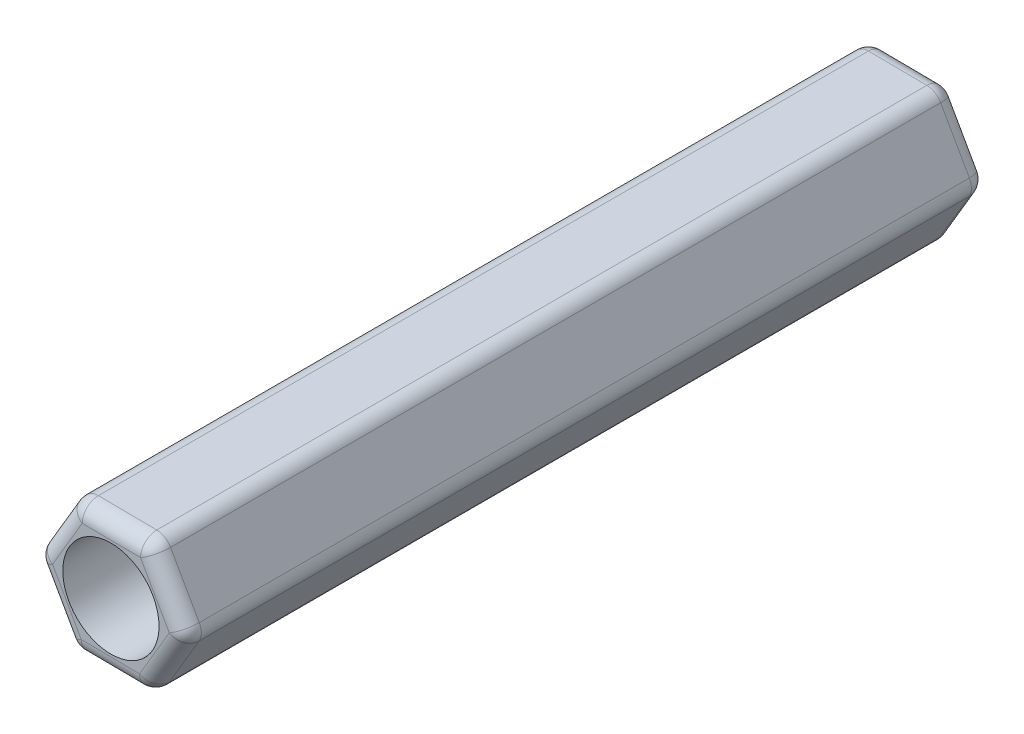
from build123d import *

# Parameters (mm, degrees)
SALIENTE_EXTRUIR1_DEPTH = 25
CROQUIS3_R              = 1.5
CORTAR_EXTRUIR1_DEPTH   = 25
REDONDEO1_R             = 0.5


with BuildPart() as part:
    # Croquis1 → Saliente-Extruir1 (new body)
    with BuildSketch(Plane.XY):
        Polygon((1.178162087, -2.086328696), (2.395894695, -0.022846051), (1.217732608, 2.063482646), (-1.178162087, 2.086328696), (-2.395894695, 0.022846051), (-1.217732608, -2.063482646), align=None)
    extrude(amount=SALIENTE_EXTRUIR1_DEPTH)

    # Croquis3 → Cortar-Extruir1 (cut)
    with BuildSketch(Plane.XY.offset(25)):
        Circle(CROQUIS3_R)
    extrude(amount=-CORTAR_EXTRUIR1_DEPTH, mode=Mode.SUBTRACT)

    # Redondeo1
    redondeo1_edges = [part.edges().sort_by_distance(p)[0] for p in [
        (1.806813652, 1.020318297, 25),
        (-1.217732608, -2.063482646, 12.5),
        (-2.395894695, 0.022846051, 12.5),
        (-1.178162087, 2.086328696, 12.5),
        (1.217732608, 2.063482646, 12.5),
        (2.395894695, -0.022846051, 12.5),
        (1.178162087, -2.086328696, 12.5),
        (0.01978526, 2.074905671, 25),
        (-1.787028391, 1.054587374, 25),
        (-1.806813652, -1.020318297, 25),
        (-0.01978526, -2.074905671, 25),
        (-1.806813652, -1.020318297, 0),
        (-1.787028391, 1.054587374, 0),
        (0.01978526, 2.074905671, 0),
        (1.787028391, -1.054587374, 25),
        (1.806813652, 1.020318297, 0),
        (1.787028391, -1.054587374, 0),
        (-0.01978526, -2.074905671, 0),
    ]]
    fillet(redondeo1_edges, radius=REDONDEO1_R)


solid = part.part
